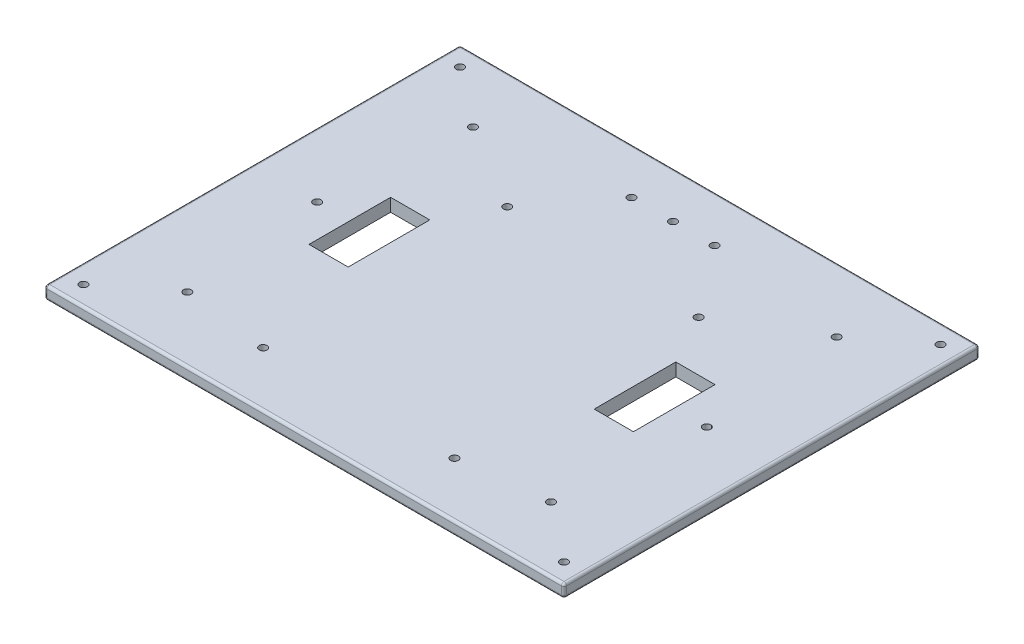
from build123d import *

# Parameters (mm, degrees)
SKETCH7_W               = 200
SKETCH7_H               = 160
BOSS_EXTRUDE5_DEPTH     = 5
SKETCH8_R               = 1.5
CUT_EXTRUDE2_DEPTH      = 129.16005618
MIRROR5_COPY_1_SKETCH_R = 1.5
MIRROR5_COPY_1_DEPTH    = 129.16005618
SKETCH11_R              = 1.5
CUT_EXTRUDE8_DEPTH      = 129.16005618
SKETCH15_R              = 1.5
CUT_EXTRUDE13_DEPTH     = 129.16005618
SKETCH17_R              = 1.5
CUT_EXTRUDE16_DEPTH     = 129.16005618
SKETCH18_R              = 1.5
CUT_EXTRUDE20_DEPTH     = 129.16005618
FILLET1_R               = 1
SKETCH19_W              = 15.093823339
SKETCH19_H              = 31.414282074
CUT_EXTRUDE21_DEPTH     = 129.16005618


with BuildPart() as part:
    # Sketch7 → Boss-Extrude5 (new body)
    with BuildSketch(Plane(origin=(0, 0, 0), x_dir=(1, 0, 0), z_dir=(0, 1, 0))):
        Rectangle(SKETCH7_W, SKETCH7_H)
    extrude(amount=BOSS_EXTRUDE5_DEPTH)

    # Sketch8 → Cut-Extrude2 (cut, through all)
    with BuildSketch(Plane(origin=(0, 0, 0), x_dir=(-1, 0, 0), z_dir=(0, -1, 0))):
        with Locations(Location((92.5, -72.5, 0), (0, 0, 90))):
            Circle(SKETCH8_R)
    cut_extrude2 = extrude(amount=-CUT_EXTRUDE2_DEPTH, mode=Mode.SUBTRACT)

    # Mirror4: Cut-Extrude2 across plane
    add(cut_extrude2.mirror(Plane.XY), mode=Mode.SUBTRACT)

    # Mirror5: Cut-Extrude2 across plane
    add(cut_extrude2.mirror(Plane(origin=(0, 0, 0), x_dir=(0, 0, 1), z_dir=(1, 0, 0))), mode=Mode.SUBTRACT)

    # Mirror5 copy 1 sketch → Mirror5 copy 1 (cut, through all)
    with BuildSketch(Plane.XZ):
        with Locations(Location((92.5, -72.5, 0), (0, 0, 90))):
            Circle(MIRROR5_COPY_1_SKETCH_R)
    extrude(amount=-MIRROR5_COPY_1_DEPTH, mode=Mode.SUBTRACT)

    # Sketch11 → Cut-Extrude8 (cut, through all)
    with BuildSketch(Plane(origin=(0, 0, 0), x_dir=(-1, 0, 0), z_dir=(0, -1, 0))):
        with Locations(Location((36.83, -58.98, 0), (0, 0, 90))):
            Circle(SKETCH11_R)
        with Locations(Location((36.83, 35, 0), (0, 0, 90))):
            Circle(SKETCH11_R)
        with Locations(Location((-36.83, -58.98, 0), (0, 0, 270))):
            Circle(SKETCH11_R)
        with Locations(Location((-36.83, 35, 0), (0, 0, 270))):
            Circle(SKETCH11_R)
    extrude(amount=-CUT_EXTRUDE8_DEPTH, mode=Mode.SUBTRACT)

    # Sketch15 → Cut-Extrude13 (cut, through all)
    with BuildSketch(Plane(origin=(0, 0, 0), x_dir=(-1, 0, 0), z_dir=(0, -1, 0))):
        with Locations(Location((70, -55, 0), (0, 0, 90))):
            Circle(SKETCH15_R)
        with Locations(Location((70, 55, 0), (0, 0, 270))):
            Circle(SKETCH15_R)
        with Locations(Location((-70, 55, 0), (0, 0, 90))):
            Circle(SKETCH15_R)
        with Locations(Location((-70, -55, 0), (0, 0, 270))):
            Circle(SKETCH15_R)
    extrude(amount=-CUT_EXTRUDE13_DEPTH, mode=Mode.SUBTRACT)

    # Sketch17 → Cut-Extrude16 (cut, through all)
    with BuildSketch(Plane(origin=(0, 0, 0), x_dir=(-1, 0, 0), z_dir=(0, -1, 0))):
        with Locations(Location((75, 0, 0), (0, 0, 90))):
            Circle(SKETCH17_R)
        with Locations(Location((-75, 0, 0), (0, 0, 270))):
            Circle(SKETCH17_R)
    extrude(amount=-CUT_EXTRUDE16_DEPTH, mode=Mode.SUBTRACT)

    # Sketch18 → Cut-Extrude20 (cut, through all)
    with BuildSketch(Plane(origin=(0, 0, 0), x_dir=(-1, 0, 0), z_dir=(0, -1, 0))):
        with Locations(Location((0, 62, 0), (0, 0, 90))):
            Circle(SKETCH18_R)
        with Locations(Location((-16, 62, 0), (0, 0, 90))):
            Circle(SKETCH18_R)
    cut_extrude20 = extrude(amount=-CUT_EXTRUDE20_DEPTH, mode=Mode.SUBTRACT)

    # Mirror12: Cut-Extrude20 across plane
    add(cut_extrude20.mirror(Plane(origin=(0, 0, 0), x_dir=(0, 0, 1), z_dir=(1, 0, 0))), mode=Mode.SUBTRACT)

    # Fillet1
    fillet1_edges = [part.edges().sort_by_distance(p)[0] for p in [
        (-100, 5, 0),
        (0, 5, 80),
        (100, 5, 0),
        (0, 0, 80),
        (-100, 0, 0),
        (0, 0, -80),
        (100, 0, 0),
        (100, 2.5, 80),
        (-100, 2.5, 80),
        (-100, 2.5, -80),
        (100, 2.5, -80),
        (0, 5, -80),
    ]]
    fillet(fillet1_edges, radius=FILLET1_R)

    # Sketch19 → Cut-Extrude21 (cut, through all)
    with BuildSketch(Plane(origin=(0, 5, 0), x_dir=(1, 0, 0), z_dir=(0, 1, 0))):
        with Locations((-54.908539981, 0)):
            Rectangle(SKETCH19_W, SKETCH19_H)
        with Locations((54.908539981, 0)):
            Rectangle(SKETCH19_W, SKETCH19_H)
    extrude(amount=-CUT_EXTRUDE21_DEPTH, mode=Mode.SUBTRACT)


solid = part.part
